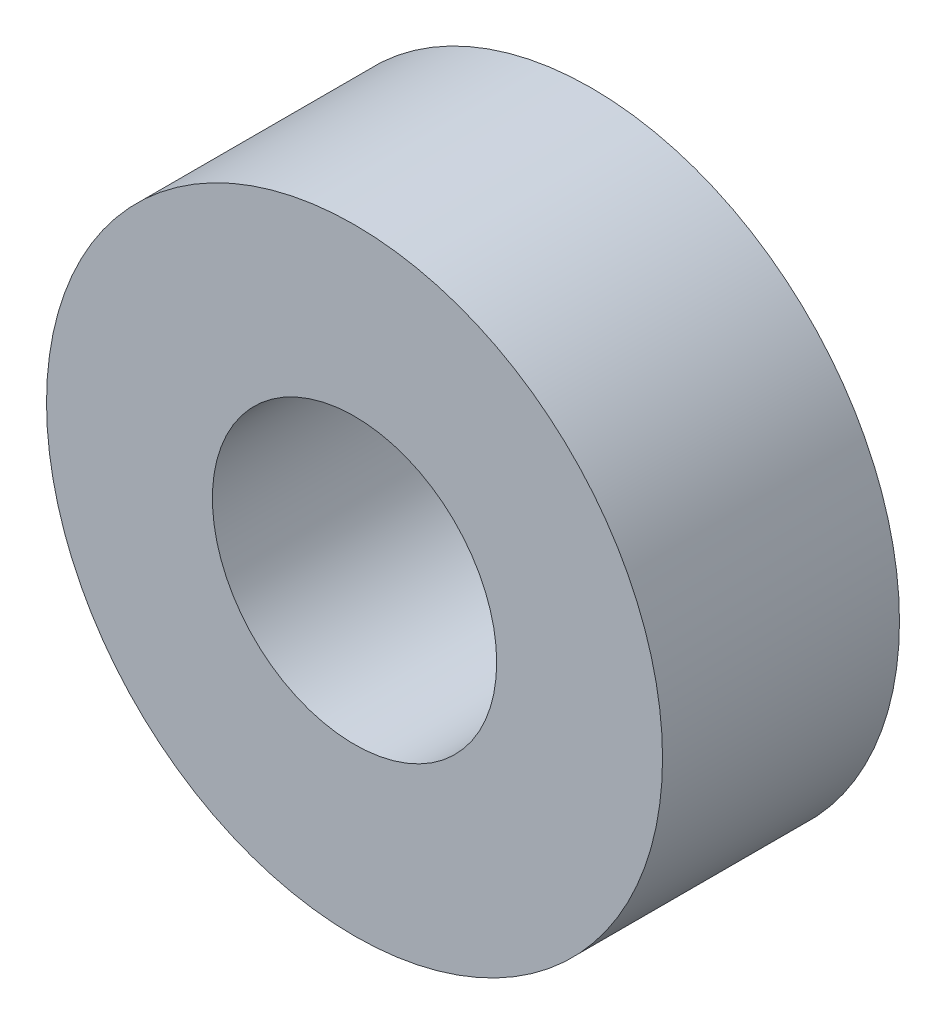
from build123d import *

# Parameters (mm, degrees)
SKETCH1_R           = 6.5
SKETCH1_R_2         = 3
BOSS_EXTRUDE1_DEPTH = 5


with BuildPart() as part:
    # Sketch1 → Boss-Extrude1 (new body)
    with BuildSketch(Plane.XY):
        Circle(SKETCH1_R)
        Circle(SKETCH1_R_2, mode=Mode.SUBTRACT)
    extrude(amount=BOSS_EXTRUDE1_DEPTH)


solid = part.part
